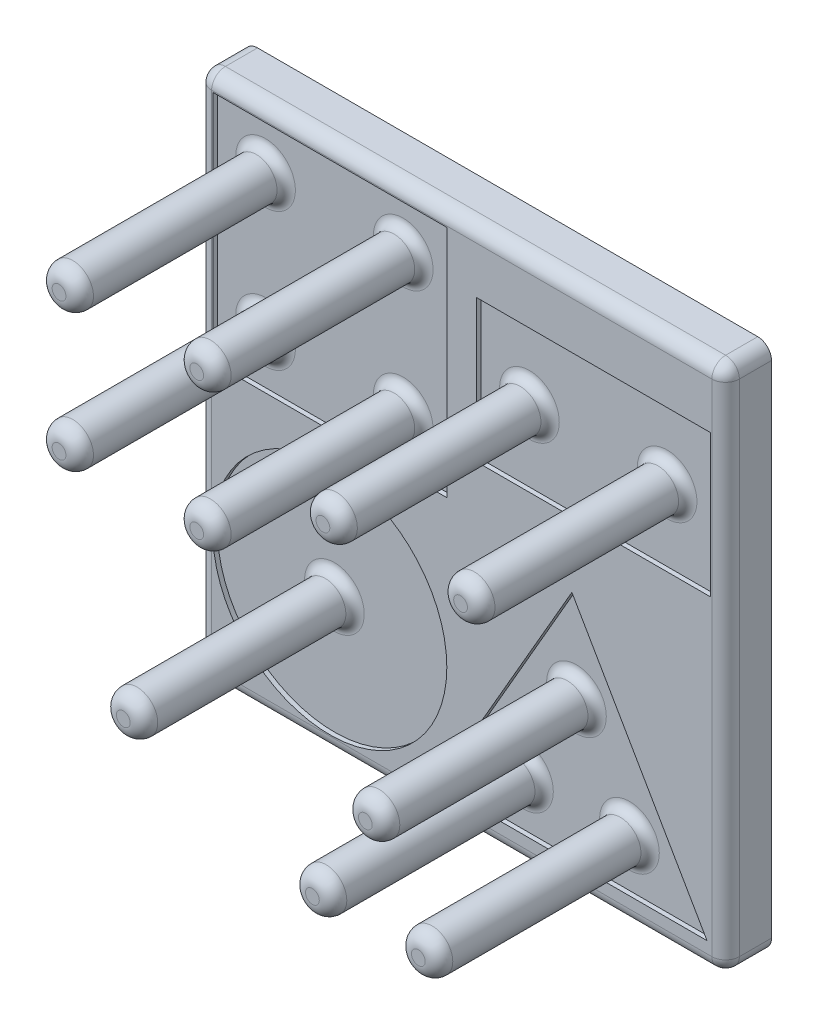
from build123d import *

# Parameters (mm, degrees)
SKETCH1_W           = 115
SKETCH1_H           = 115
BOSS_EXTRUDE1_DEPTH = 10
SKETCH2_W           = 51
SKETCH2_H           = 51
CUT_EXTRUDE1_DEPTH  = 1
SKETCH3_R           = 4.5
BOSS_EXTRUDE2_DEPTH = 45
FILLET1_R           = 2
FILLET2_R           = 3
SKETCH4_W           = 51
SKETCH4_H           = 31
CUT_EXTRUDE2_DEPTH  = 1
SKETCH5_R           = 4.5
BOSS_EXTRUDE3_DEPTH = 45
FILLET3_R           = 3
FILLET4_R           = 2
SKETCH11_R          = 25.5
SKETCH11_R_2        = 4.5
CUT_EXTRUDE5_DEPTH  = 1
BOSS_EXTRUDE5_START = 45
SKETCH14_R          = 4.5
BOSS_EXTRUDE5_DEPTH = 45
FILLET7_R           = 3
FILLET8_R           = 2
SKETCH6_R           = 4.5
CUT_EXTRUDE6_DEPTH  = 1
BOSS_EXTRUDE6_START = 45
SKETCH16_R          = 4.5
BOSS_EXTRUDE6_DEPTH = 45
FILLET9_R           = 2
FILLET10_R          = 3
FILLET11_R          = 3


with BuildPart() as part:
    # Sketch1 → Boss-Extrude1 (new body)
    with BuildSketch(Plane.XY):
        Rectangle(SKETCH1_W, SKETCH1_H)
    extrude(amount=BOSS_EXTRUDE1_DEPTH)

    # Sketch2 → Cut-Extrude1 (cut)
    with BuildSketch(Plane.XY.offset(10)):
        with Locations((-28.75, 28.75)):
            Rectangle(SKETCH2_W, SKETCH2_H)
    extrude(amount=-CUT_EXTRUDE1_DEPTH, mode=Mode.SUBTRACT)

    # Sketch3 → Boss-Extrude2 (add)
    with BuildSketch(Plane.XY.offset(9)):
        with Locations(Location((-43.75, 43.75, 0), (0, 0, 180))):
            Circle(SKETCH3_R)
        with Locations(Location((-13.75, 43.75, 0), (0, 0, 180))):
            Circle(SKETCH3_R)
        with Locations(Location((-13.75, 13.75, 0), (0, 0, 180))):
            Circle(SKETCH3_R)
        with Locations(Location((-43.75, 13.75, 0), (0, 0, 180))):
            Circle(SKETCH3_R)
    extrude(amount=BOSS_EXTRUDE2_DEPTH)

    # Fillet1
    fillet1_edges = [part.edges().sort_by_distance(p)[0] for p in [
        (-39.25, 43.75, 9),
        (-9.25, 43.75, 9),
        (-9.25, 13.75, 9),
        (-39.25, 13.75, 9),
    ]]
    fillet(fillet1_edges, radius=FILLET1_R)

    # Fillet2
    fillet2_edges = [part.edges().sort_by_distance(p)[0] for p in [
        (-39.25, 43.75, 54),
        (-9.25, 43.75, 54),
        (-9.25, 13.75, 54),
        (-39.25, 13.75, 54),
    ]]
    fillet(fillet2_edges, radius=FILLET2_R)

    # Sketch4 → Cut-Extrude2 (cut)
    with BuildSketch(Plane.XY.offset(10)):
        with Locations((28.75, 28.75)):
            Rectangle(SKETCH4_W, SKETCH4_H)
    extrude(amount=-CUT_EXTRUDE2_DEPTH, mode=Mode.SUBTRACT)

    # Sketch5 → Boss-Extrude3 (add)
    with BuildSketch(Plane.XY.offset(9)):
        with Locations(Location((13.75, 28.75, 0), (0, 0, 180))):
            Circle(SKETCH5_R)
        with Locations(Location((43.75, 28.75, 0), (0, 0, 180))):
            Circle(SKETCH5_R)
    extrude(amount=BOSS_EXTRUDE3_DEPTH)

    # Fillet3
    fillet3_edges = [part.edges().sort_by_distance(p)[0] for p in [
        (18.25, 28.75, 54),
        (48.25, 28.75, 54),
    ]]
    fillet(fillet3_edges, radius=FILLET3_R)

    # Fillet4
    fillet4_edges = [part.edges().sort_by_distance(p)[0] for p in [
        (18.25, 28.75, 9),
        (48.25, 28.75, 9),
    ]]
    fillet(fillet4_edges, radius=FILLET4_R)

    # Sketch11 → Cut-Extrude5 (cut)
    with BuildSketch(Plane.XY.offset(10)):
        with Locations((-28.75, -28.75)):
            Circle(SKETCH11_R)
        with Locations((-28.75, -28.75)):
            Circle(SKETCH11_R_2, mode=Mode.SUBTRACT)
    extrude(amount=-CUT_EXTRUDE5_DEPTH, mode=Mode.SUBTRACT)

    # Sketch14 → Boss-Extrude5 (add)
    with BuildSketch(Plane.XY.offset(10).offset(BOSS_EXTRUDE5_START)):
        with Locations((-28.75, -28.75)):
            Circle(SKETCH14_R)
    extrude(amount=-BOSS_EXTRUDE5_DEPTH)

    # Fillet7
    fillet7_edges = [part.edges().sort_by_distance(p)[0] for p in [
        (-33.25, -28.75, 55),
    ]]
    fillet(fillet7_edges, radius=FILLET7_R)

    # Fillet8
    fillet8_edges = [part.edges().sort_by_distance(p)[0] for p in [
        (-33.25, -28.75, 9),
    ]]
    fillet(fillet8_edges, radius=FILLET8_R)

    # Sketch6 → Cut-Extrude6 (cut)
    with BuildSketch(Plane.XY.offset(10)):
        Polygon((24, -1), (-5.444863729, -52), (53.444863729, -52), align=None)
        with Locations((24, -21.666666667)):
            Circle(SKETCH6_R, mode=Mode.SUBTRACT)
        with Locations((35.547005384, -41.666666667)):
            Circle(SKETCH6_R, mode=Mode.SUBTRACT)
        with Locations((12.452994616, -41.666666667)):
            Circle(SKETCH6_R, mode=Mode.SUBTRACT)
    extrude(amount=-CUT_EXTRUDE6_DEPTH, mode=Mode.SUBTRACT)

    # Sketch16 → Boss-Extrude6 (add)
    with BuildSketch(Plane.XY.offset(10).offset(BOSS_EXTRUDE6_START)):
        with Locations((24, -21.666666667)):
            Circle(SKETCH16_R)
        with Locations((12.452994616, -41.666666667)):
            Circle(SKETCH16_R)
        with Locations((35.547005384, -41.666666667)):
            Circle(SKETCH16_R)
    extrude(amount=-BOSS_EXTRUDE6_DEPTH)

    # Fillet9
    fillet9_edges = [part.edges().sort_by_distance(p)[0] for p in [
        (7.952994616, -41.666666667, 9),
        (31.047005384, -41.666666667, 9),
        (19.5, -21.666666667, 9),
    ]]
    fillet(fillet9_edges, radius=FILLET9_R)

    # Fillet10
    fillet10_edges = [part.edges().sort_by_distance(p)[0] for p in [
        (19.5, -21.666666667, 55),
        (7.952994616, -41.666666667, 55),
        (31.047005384, -41.666666667, 55),
    ]]
    fillet(fillet10_edges, radius=FILLET10_R)

    # Fillet11
    fillet11_edges = [part.edges().sort_by_distance(p)[0] for p in [
        (57.5, 0, 10),
        (0, 57.5, 10),
        (-57.5, 0, 10),
        (0, -57.5, 10),
        (-57.5, 57.5, 5),
        (57.5, 57.5, 5),
        (57.5, -57.5, 5),
        (-57.5, -57.5, 5),
    ]]
    fillet(fillet11_edges, radius=FILLET11_R)


solid = part.part
